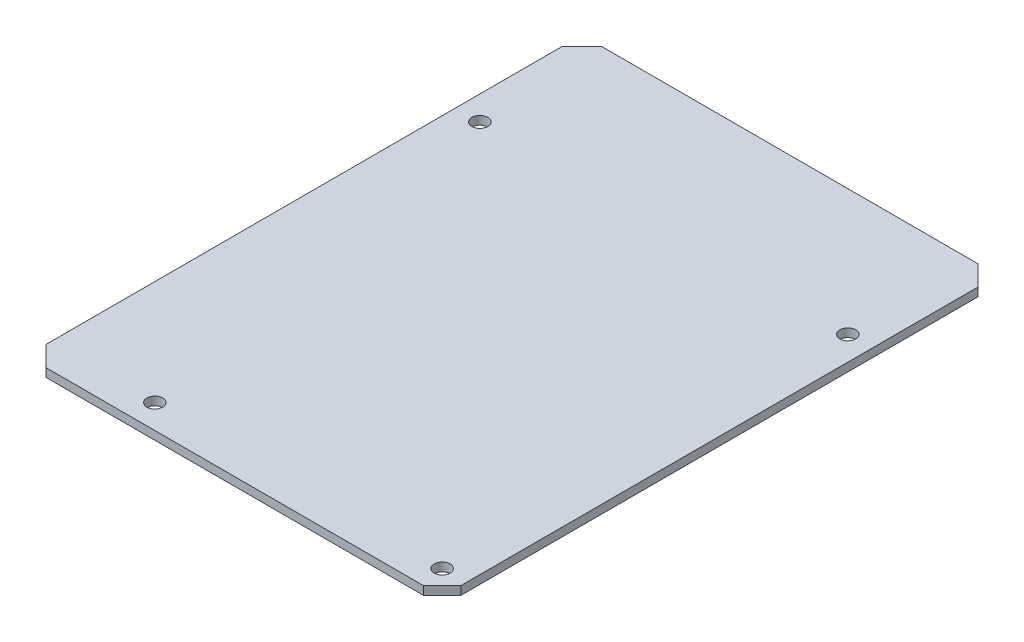
from build123d import *

# Parameters (mm, degrees)
REP_RES_R = 1.5
CI_DEPTH  = 1.6


with BuildPart() as part:
    # Repères → CI (new body)
    with BuildSketch(Plane(origin=(0, 0, 0), x_dir=(1, 0, 0), z_dir=(0, 1, 0))):
        Polygon((-35.56, 52.58), (-39.37, 48.77), (-39.37, -48.77), (-35.56, -52.58), (35.814, -52.58), (39.37, -49.024), (39.37, 48.77), (35.56, 52.58), align=None)
        with Locations(Location((-34.79, 28.702, 0), (0, 0, 270))):
            Circle(REP_RES_R, mode=Mode.SUBTRACT)
        with Locations(Location((34.81, 28.702, 0), (0, 0, 270))):
            Circle(REP_RES_R, mode=Mode.SUBTRACT)
        with Locations(Location((34.81, -48.008, 0), (0, 0, 270))):
            Circle(REP_RES_R, mode=Mode.SUBTRACT)
        with Locations(Location((-19.55, -48.008, 0), (0, 0, 270))):
            Circle(REP_RES_R, mode=Mode.SUBTRACT)
    extrude(amount=CI_DEPTH)


solid = part.part
